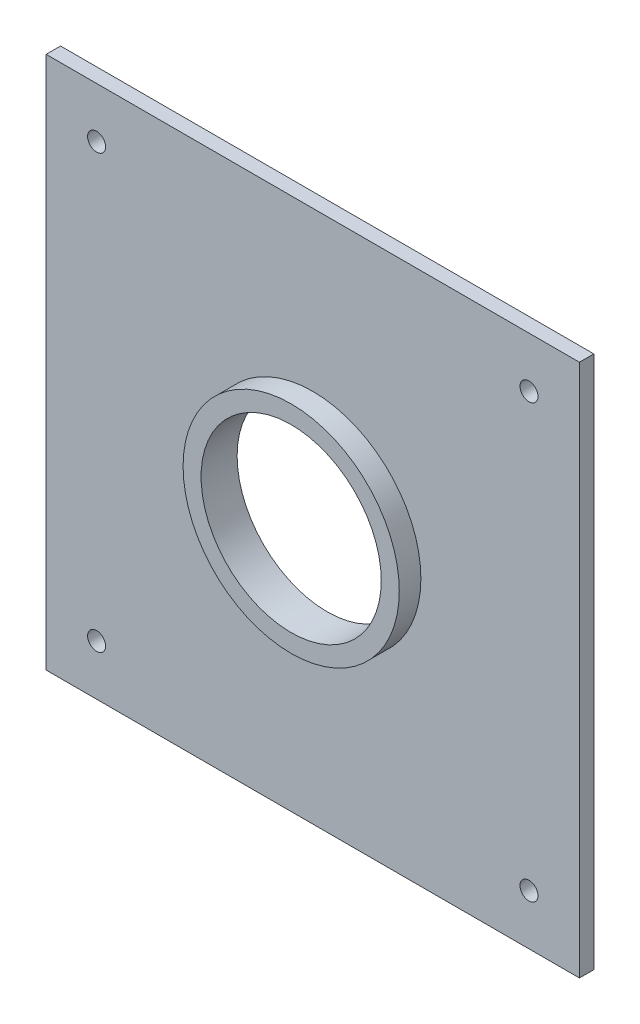
from build123d import *

# Parameters (mm, degrees)
SKETCH_2_W          = 74
SKETCH_2_H          = 74
EXTRUDE_1_DEPTH     = 2
SKETCH_3_R          = 15
EXTRUDE_2_DEPTH     = 3
SKETCH_4_R          = 12.5
CUT_EXTRUDE_1_DEPTH = 10
M3X0_5_1_D          = 2.5


with BuildPart() as part:
    # ｽｹｯﾁ2 → ﾎﾞｽ - 押し出し1 (new body)
    with BuildSketch(Plane.XY):
        with Locations((-37, -37)):
            Rectangle(SKETCH_2_W, SKETCH_2_H)
    extrude(amount=EXTRUDE_1_DEPTH)

    # ｽｹｯﾁ3 → ﾎﾞｽ - 押し出し2 (add)
    with BuildSketch(Plane.XY.offset(2)):
        with Locations(Location((-37, -37, 0), (0, 0, 180))):
            Circle(SKETCH_3_R)
    extrude(amount=EXTRUDE_2_DEPTH)

    # ｽｹｯﾁ4 → ｶｯﾄ - 押し出し1 (cut)
    with BuildSketch(Plane.XY.offset(5)):
        with Locations((-37, -37)):
            Circle(SKETCH_4_R)
    extrude(amount=-CUT_EXTRUDE_1_DEPTH, mode=Mode.SUBTRACT)

    # M3x0.5 ねじ穴1 (through all)
    with Locations(Plane.XY.offset(2)):
        with Locations((-67, -67), (-7, -67)):
            m3x0_5_1 = Hole(M3X0_5_1_D / 2)

    # ﾐﾗｰ1: M3x0.5 ねじ穴1 across plane
    add(m3x0_5_1.mirror(Plane.ZX.offset(-37)), mode=Mode.SUBTRACT)


solid = part.part
